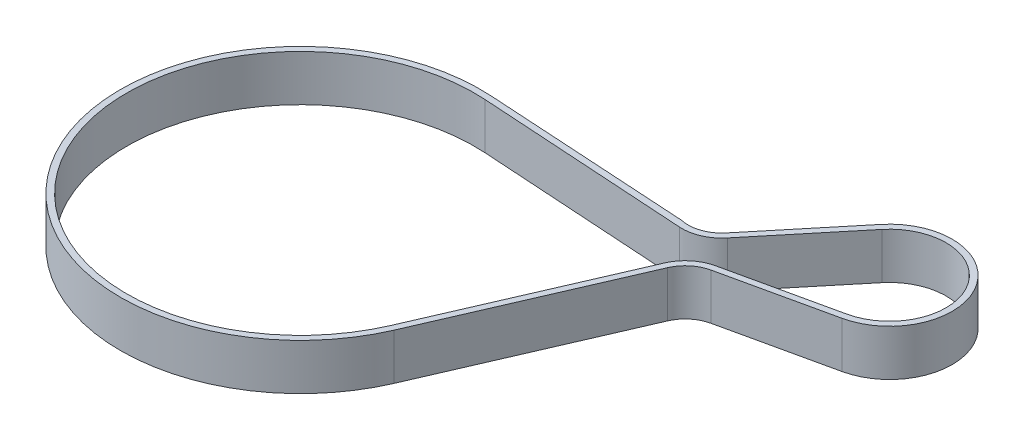
from build123d import *
from build123d.topology import SkipClean

# Parameters (mm, degrees)
BOSS_EXTRUDE1_DEPTH = 7
BOSS_EXTRUDE2_DEPTH = 0.5


with BuildPart() as part:
    # Sketch1 → Boss-Extrude1 (new body)
    with BuildSketch(Plane(origin=(0, 0, 0), x_dir=(1, 0, 0), z_dir=(0, 1, 0))):
        with BuildLine():
            Line((29.22824924, 30.681159688), (17.850659856, 16.897054356))
            ThreePointArc((17.850659856, 16.897054356), (15.379675631, 15.1910369), (12.380917697, 15.03705815))
            Line((12.380917697, 15.03705815), (-20.537634361, 17.060906053))
            ThreePointArc((-20.537634361, 17.060906053), (-47.281869491, -27.461627718), (4.525488573, -23.786335009))
            Line((4.525488573, -23.786335009), (17.958953394, 7.231589211))
            ThreePointArc((17.958953394, 7.231589211), (19.505297976, 9.287886756), (21.817685297, 10.415896524))
            Line((21.817685297, 10.415896524), (39.268754989, 14.277407445))
            ThreePointArc((39.268754989, 14.277407445), (45.745634232, 29.516516233), (29.22824924, 30.681159688))
        make_face()
        with BuildLine():
            ThreePointArc((3.607850555, -23.388917762), (-46.445589463, -26.91243355), (-20.537634361, 16.058950924))
            Line((-20.537634361, 16.058950924), (13.195989156, 13.911337267))
            ThreePointArc((13.195989156, 13.911337267), (16.191497408, 14.433261737), (18.621876492, 16.260481579))
            Line((18.621876492, 16.260481579), (29.999465876, 30.044586911))
            ThreePointArc((29.999465876, 30.044586911), (44.89272255, 28.994461003), (39.05270459, 15.253789658))
            Line((39.05270459, 15.253789658), (21.601634898, 11.392278737))
            ThreePointArc((21.601634898, 11.392278737), (18.868813518, 10.059176283), (17.041315376, 7.629006457))
            Line((17.041315376, 7.629006457), (3.607850555, -23.388917762))
        make_face(mode=Mode.SUBTRACT)
    extrude(amount=BOSS_EXTRUDE1_DEPTH)

    # Sketch2 → Boss-Extrude2 (add)
    with SkipClean():  # the faces are left unmerged after this step: merging them gives an invalid solid
        with BuildSketch(Plane(origin=(0, 7, 0), x_dir=(1, 0, 0), z_dir=(0, 1, 0))):
            with BuildLine():
                Line((4.525488573, -23.786335009), (17.958953394, 7.231589211))
                ThreePointArc((17.958953394, 7.231589211), (19.505297976, 9.287886756), (21.817685297, 10.415896524))
                Line((21.817685297, 10.415896524), (39.268754989, 14.277407445))
                ThreePointArc((39.268754989, 14.277407445), (45.745634232, 29.516516233), (29.22824924, 30.681159688))
                Line((29.22824924, 30.681159688), (17.850659856, 16.897054356))
                ThreePointArc((17.850659856, 16.897054356), (15.379675631, 15.1910369), (12.380917697, 15.03705815))
                Line((12.380917697, 15.03705815), (-20.537634361, 17.060906053))
                ThreePointArc((-20.537634361, 17.060906053), (-47.281869491, -27.461627718), (4.525488573, -23.786335009))
            make_face()
            with BuildLine():
                Line((21.601634898, 11.392278737), (39.05270459, 15.253789658))
                ThreePointArc((39.05270459, 15.253789658), (44.89272255, 28.994461003), (29.999465876, 30.044586911))
                Line((29.999465876, 30.044586911), (18.621876492, 16.260481579))
                ThreePointArc((18.621876492, 16.260481579), (16.191497408, 14.433261737), (13.195989156, 13.911337267))
                Line((13.195989156, 13.911337267), (-20.537634361, 16.058950924))
                ThreePointArc((-20.537634361, 16.058950924), (-46.445589463, -26.91243355), (3.607850555, -23.388917762))
                Line((3.607850555, -23.388917762), (17.041315376, 7.629006457))
                ThreePointArc((17.041315376, 7.629006457), (18.868813518, 10.059176283), (21.601634898, 11.392278737))
            make_face(mode=Mode.SUBTRACT)
        extrude(amount=BOSS_EXTRUDE2_DEPTH)


solid = part.part
